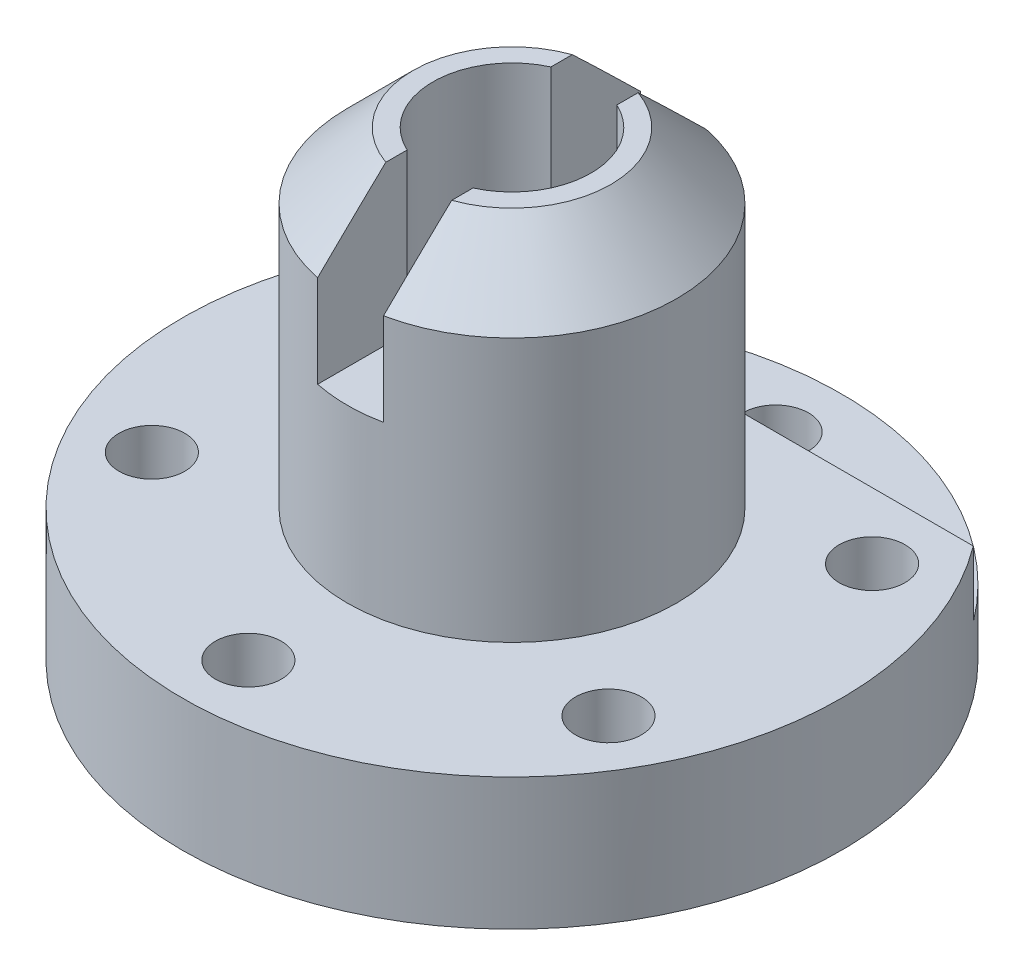
from build123d import *

# Parameters (mm, degrees)
SKETCH1_R               = 25
BOSS_EXTRUDE1_DEPTH     = 10
SKETCH1_3_R             = 12.5
SKETCH1_3_R_2           = 6
BOSS_EXTRUDE2_DEPTH     = 35
CUT_EXTRUDE1_START      = 5
CUT_EXTRUDE1_DEPTH      = 5
CUT_EXTRUDE2_DEPTH      = 50.749371855
CUT_EXTRUDE2_DEPTH_BACK = 50.749371855
SKETCH2_W               = 5
SKETCH2_H               = 12
SKETCH3_R               = 2.5
CUT_EXTRUDE3_DEPTH      = 50.749371855
CIRPATTERN1_COUNT       = 6
CHAMFER1_SIZE           = 5


with BuildPart() as part:
    # Sketch1 → Boss-Extrude1 (new body)
    with BuildSketch(Plane(origin=(0, 0, 0), x_dir=(1, 0, 0), z_dir=(0, 1, 0))):
        with Locations(Location((0, 0, 0), (0, 0, 270))):
            Circle(SKETCH1_R)
    extrude(amount=BOSS_EXTRUDE1_DEPTH)

    # Sketch1<3> → Boss-Extrude2 (add)
    with BuildSketch(Plane(origin=(0, 0, 0), x_dir=(1, 0, 0), z_dir=(0, 1, 0))):
        with Locations(Location((0, 0, 0), (0, 0, 270))):
            Circle(SKETCH1_3_R)
        with Locations(Location((0, 0, 0), (0, 0, 270))):
            Circle(SKETCH1_3_R_2, mode=Mode.SUBTRACT)
    extrude(amount=BOSS_EXTRUDE2_DEPTH)

    # Sketch1<5> → Cut-Extrude1 (cut)
    with BuildSketch(Plane(origin=(0, 0, 0), x_dir=(1, 0, 0), z_dir=(0, 1, 0)).offset(CUT_EXTRUDE1_START)):
        with BuildLine():
            ThreePointArc((20, 15), (0, 25), (-20, 15))
            Line((-20, 15), (20, 15))
        make_face()
    extrude(amount=CUT_EXTRUDE1_DEPTH, mode=Mode.SUBTRACT)

    # Sketch2 → Cut-Extrude2 (cut, two sides: drawn at the far end of the back side and taken through both)
    with BuildSketch(Plane.XY.offset(-CUT_EXTRUDE2_DEPTH_BACK)):
        with Locations((0, 29)):
            Rectangle(SKETCH2_W, SKETCH2_H)
    extrude(amount=CUT_EXTRUDE2_DEPTH + CUT_EXTRUDE2_DEPTH_BACK, mode=Mode.SUBTRACT)

    # Sketch3 → Cut-Extrude3 (cut, through all)
    with BuildSketch(Plane(origin=(0, 0, 0), x_dir=(1, 0, 0), z_dir=(0, 1, 0))):
        with Locations(Location((0, 20, 0), (0, 0, 270))):
            Circle(SKETCH3_R)
    cut_extrude3 = extrude(amount=CUT_EXTRUDE3_DEPTH, mode=Mode.SUBTRACT)

    # CirPattern1: Cut-Extrude3 ×6 about axis
    cirpattern1_axis = Axis((0, 0, 0), (0, 1, 0))
    for i in range(1, CIRPATTERN1_COUNT):
        add(cut_extrude3.rotate(cirpattern1_axis, i * 360 / CIRPATTERN1_COUNT), mode=Mode.SUBTRACT)

    # Chamfer1
    chamfer1_edges = [part.edges().sort_by_distance(p)[0] for p in [
        (-12.5, 35, 0),
        (12.5, 35, 0),
    ]]
    chamfer(chamfer1_edges, length=CHAMFER1_SIZE)


solid = part.part
